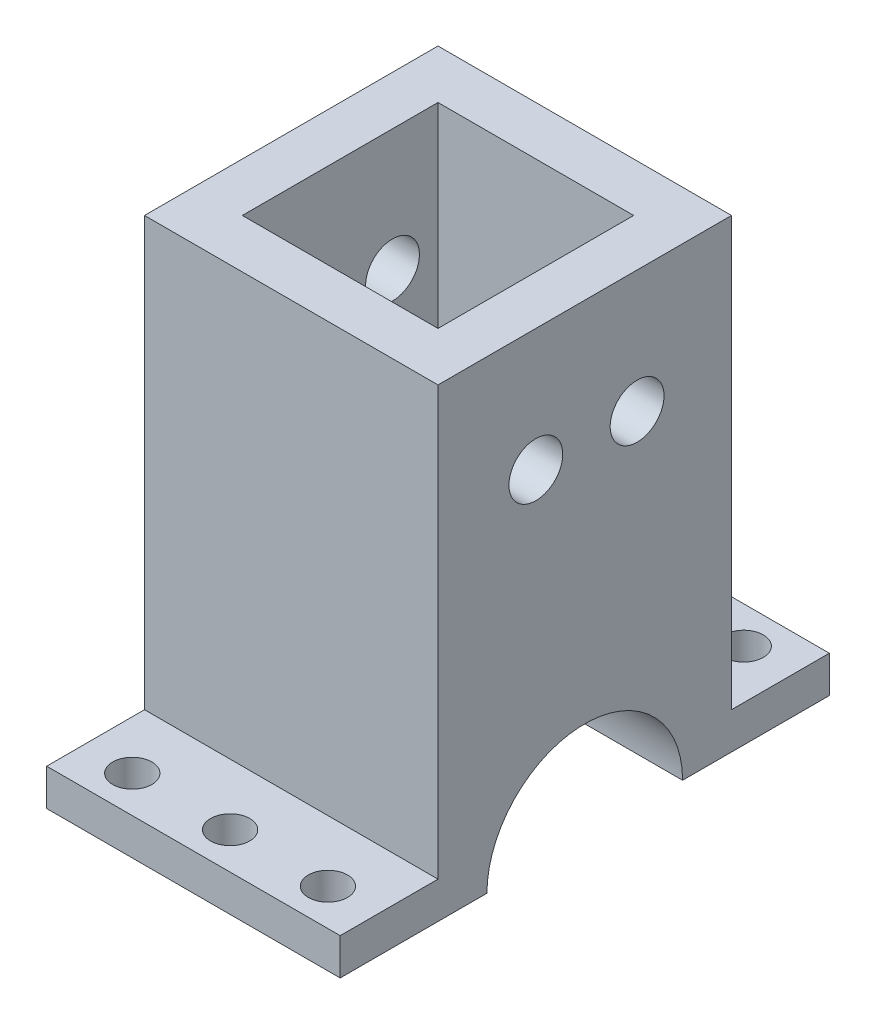
from build123d import *

# Parameters (mm, degrees)
SKETCH_1_W          = 16
SKETCH_1_H          = 16
EXTRUDE_1_DEPTH     = 20
SKETCH_2_W          = 24
SKETCH_2_H          = 24
EXTRUDE_4_DEPTH     = 10
SKETCH_3_W          = 4
SKETCH_3_H          = 3
EXTRUDE_6_DEPTH     = 24
SKETCH_5_R          = 1.6
CUT_EXTRUDE_1_DEPTH = 24
SKETCH_6_R          = 2.2
CUT_EXTRUDE_2_DEPTH = 25


with BuildPart() as part:
    # 草图1 → 凸台-拉伸1 (new body)
    with BuildSketch(Plane(origin=(0, 0, 0), x_dir=(1, 0, 0), z_dir=(0, 1, 0))):
        Polygon((-4, 20), (-4, 16), (-4, -4), (16, -4), (20, -4), (20, 0), (20, 20), (0, 20), align=None)
        with Locations((8, 8)):
            Rectangle(SKETCH_1_W, SKETCH_1_H, mode=Mode.SUBTRACT)
    extrude(amount=-EXTRUDE_1_DEPTH)

    # 草图2 → 凸台-拉伸4 (add)
    with BuildSketch(Plane.XZ.offset(20)):
        with Locations((8, -8)):
            Rectangle(SKETCH_2_W, SKETCH_2_H)
    extrude(amount=EXTRUDE_4_DEPTH)

    # 草图3 → 凸台-拉伸6 (add)
    with BuildSketch(Plane.ZY.offset(4)):
        with Locations((10, -36.5)):
            Rectangle(SKETCH_3_W, SKETCH_3_H)
        with BuildLine():
            Line((4, -35), (4, -30))
            Line((4, -30), (-8.000000062, -30))
            ThreePointArc((-8.000000062, -30), (-2.343145773, -32.343145728), (0, -38))
            Line((0, -38), (8, -38))
            Line((8, -38), (8, -35))
            Line((8, -35), (4, -35))
        make_face()
        with BuildLine():
            ThreePointArc((-16, -38), (-13.656854272, -32.343145773), (-8.000000062, -30))
            Line((-8.000000062, -30), (-20, -30))
            Line((-20, -30), (-20, -35))
            Line((-20, -35), (-24, -35))
            Line((-24, -35), (-24, -38))
            Line((-24, -38), (-16, -38))
        make_face()
        with Locations((-26, -36.5)):
            Rectangle(SKETCH_3_W, SKETCH_3_H)
    extrude(amount=-EXTRUDE_6_DEPTH)

    # 草图5 → 切除-拉伸1 (cut)
    with BuildSketch(Plane.XZ.offset(38)):
        with Locations(Location((8, 9, 0), (0, 0, 270))):
            Circle(SKETCH_5_R)
        with Locations(Location((16, 9, 0), (0, 0, 270))):
            Circle(SKETCH_5_R)
        with Locations(Location((0, 9, 0), (0, 0, 90))):
            Circle(SKETCH_5_R)
        with Locations(Location((0, -25, 0), (0, 0, 270))):
            Circle(SKETCH_5_R)
        with Locations(Location((8, -25, 0), (0, 0, 270))):
            Circle(SKETCH_5_R)
        with Locations(Location((16, -25, 0), (0, 0, 270))):
            Circle(SKETCH_5_R)
    extrude(amount=-CUT_EXTRUDE_1_DEPTH, mode=Mode.SUBTRACT)

    # 草图6 → 切除-拉伸2 (cut, symmetric)
    with BuildSketch(Plane(origin=(0, 0, 0), x_dir=(0, 0, -1), z_dir=(1, 0, 0))):
        with Locations((12.280139498, -10)):
            Circle(SKETCH_6_R)
        with Locations((4, -10)):
            Circle(SKETCH_6_R)
    extrude(amount=CUT_EXTRUDE_2_DEPTH, both=True, mode=Mode.SUBTRACT)


solid = part.part
